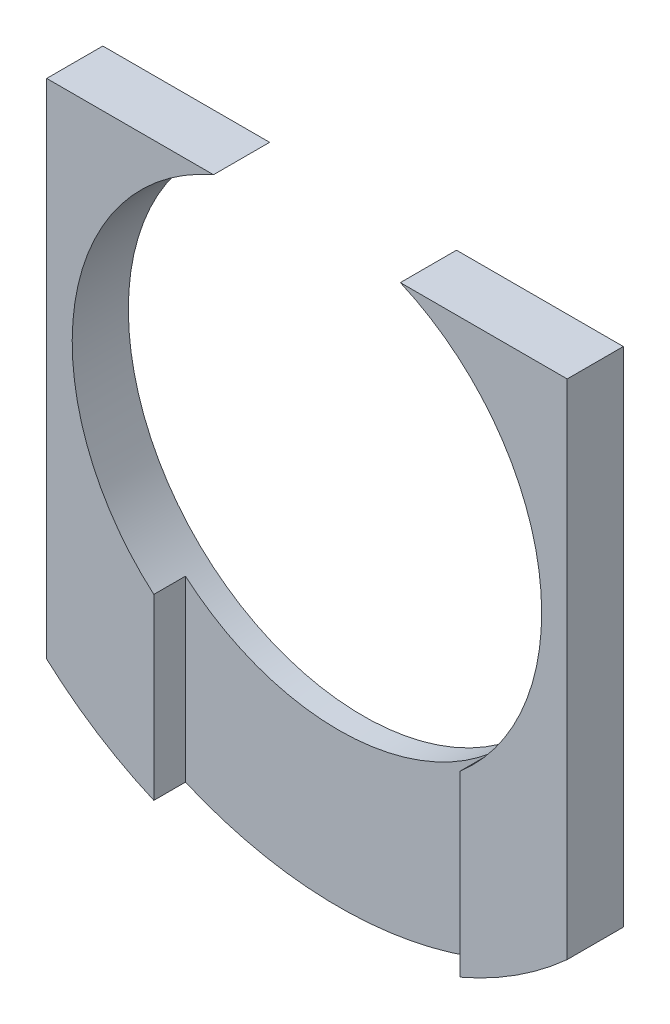
from build123d import *

# Parameters (mm, degrees)
S_CYL1_R       = 19
BOSS_1_DEPTH   = 2.75
S_HOLE2_R      = 11.5
HOLE_2_DEPTH   = 2.95
S_CUT3_W       = 7.25
S_CUT3_H       = 40
POCKET_3_DEPTH = 2.95
S_CUT4_W       = 7.25
S_CUT4_H       = 40
POCKET_4_DEPTH = 2.95
S_CUT5_W       = 40
S_CUT5_H       = 9.45
POCKET_5_DEPTH = 2.95
S_CUT6_W       = 15
S_CUT6_H       = 11.9
POCKET_6_DEPTH = 1.65


with BuildPart() as part:
    # S_cyl1 → Boss_1 (new body)
    with BuildSketch(Plane.XY.offset(30.1)):
        Circle(S_CYL1_R)
    extrude(amount=BOSS_1_DEPTH)

    # S_hole2 → Hole_2 (cut)
    with BuildSketch(Plane.XY.offset(30)):
        with Locations(Location((0, 0, 0), (0, 0, 180))):
            Circle(S_HOLE2_R)
    extrude(amount=HOLE_2_DEPTH, mode=Mode.SUBTRACT)

    # S_cut3 → Pocket_3 (cut)
    with BuildSketch(Plane.XY.offset(30)):
        with Locations((16.375, 0)):
            Rectangle(S_CUT3_W, S_CUT3_H)
    extrude(amount=POCKET_3_DEPTH, mode=Mode.SUBTRACT)

    # S_cut4 → Pocket_4 (cut)
    with BuildSketch(Plane.XY.offset(30)):
        with Locations((-16.375, 0)):
            Rectangle(S_CUT4_W, S_CUT4_H)
    extrude(amount=POCKET_4_DEPTH, mode=Mode.SUBTRACT)

    # S_cut5 → Pocket_5 (cut)
    with BuildSketch(Plane.XY.offset(30)):
        with Locations((0, 15.275)):
            Rectangle(S_CUT5_W, S_CUT5_H)
    extrude(amount=POCKET_5_DEPTH, mode=Mode.SUBTRACT)

    # S_cut6 → Pocket_6 (cut)
    with BuildSketch(Plane.XY.offset(31.3)):
        with Locations((0, -14.05)):
            Rectangle(S_CUT6_W, S_CUT6_H)
    extrude(amount=POCKET_6_DEPTH, mode=Mode.SUBTRACT)


solid = part.part
